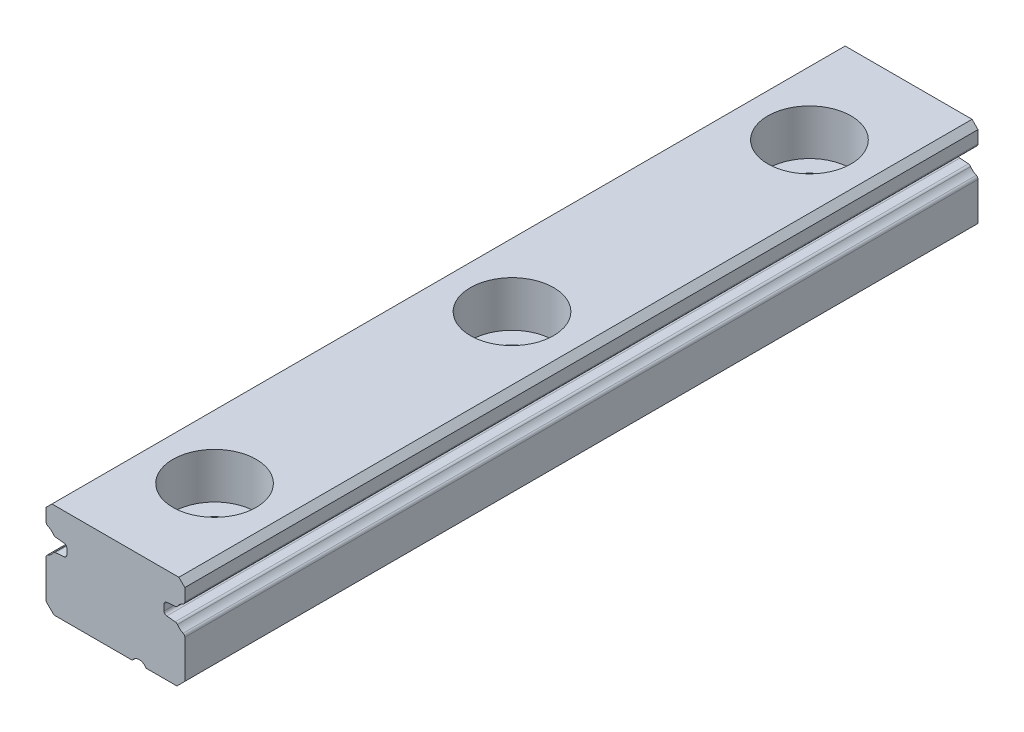
from build123d import *

# Parameters (mm, degrees)
BOSS_EXTRUDE1_START = 20
BOSS_EXTRUDE1_DEPTH = 40
LPATTERN1_COUNT     = 3
LPATTERN1_PITCH     = 15


with BuildPart() as part:
    # Sketch3 → Boss-Extrude1 (new body)
    with BuildSketch(Plane.XY.offset(BOSS_EXTRUDE1_START)):
        with BuildLine():
            Line((-3.5, -0.074596669), (-3.5, -2))
            Line((-3.5, -2), (-3.1, -2.4))
            Line((-3.1, -2.4), (0.853589838, -2.4))
            ThreePointArc((0.853589838, -2.4), (1.2, -2.2), (1.546410162, -2.4))
            Line((1.546410162, -2.4), (3.1, -2.4))
            Line((3.1, -2.4), (3.5, -2))
            Line((3.5, -2), (3.5, -0.074596669))
            ThreePointArc((3.5, -0.074596669), (3.476025208, 0.006752252), (3.411764706, 0.062096861))
            ThreePointArc((3.411764706, 0.062096861), (3.252980354, 0.161322512), (3.126179073, 0.299089108))
            ThreePointArc((3.126179073, 0.299089108), (3.078284539, 0.343044682), (3.016290807, 0.362608836))
            Line((3.016290807, 0.362608836), (2.586926639, 0.400173333))
            ThreePointArc((2.586926639, 0.400173333), (2.489408399, 0.448264007), (2.45, 0.549602538))
            Line((2.45, 0.549602538), (2.45, 0.850397462))
            ThreePointArc((2.45, 0.850397462), (2.489408399, 0.951735993), (2.586926639, 0.999826667))
            Line((2.586926639, 0.999826667), (3.016290807, 1.037391164))
            ThreePointArc((3.016290807, 1.037391164), (3.078284539, 1.056955318), (3.126179073, 1.100910892))
            ThreePointArc((3.126179073, 1.100910892), (3.252980354, 1.238677488), (3.411764706, 1.337903139))
            ThreePointArc((3.411764706, 1.337903139), (3.476025208, 1.393247748), (3.5, 1.474596669))
            Line((3.5, 1.474596669), (3.5, 2.1))
            Line((3.5, 2.1), (3.2, 2.4))
            Line((3.2, 2.4), (-3.2, 2.4))
            Line((-3.2, 2.4), (-3.5, 2.1))
            Line((-3.5, 2.1), (-3.5, 1.474596669))
            ThreePointArc((-3.5, 1.474596669), (-3.476025208, 1.393247748), (-3.411764706, 1.337903139))
            ThreePointArc((-3.411764706, 1.337903139), (-3.252980354, 1.238677488), (-3.126179073, 1.100910892))
            ThreePointArc((-3.126179073, 1.100910892), (-3.078284539, 1.056955318), (-3.016290807, 1.037391164))
            Line((-3.016290807, 1.037391164), (-2.586926639, 0.999826667))
            ThreePointArc((-2.586926639, 0.999826667), (-2.489408399, 0.951735993), (-2.45, 0.850397462))
            Line((-2.45, 0.850397462), (-2.45, 0.549602538))
            ThreePointArc((-2.45, 0.549602538), (-2.489408399, 0.448264006), (-2.586926639, 0.400173333))
            Line((-2.586926639, 0.400173333), (-3.016290807, 0.362608836))
            ThreePointArc((-3.016290807, 0.362608836), (-3.078284539, 0.343044682), (-3.126179073, 0.299089108))
            ThreePointArc((-3.126179073, 0.299089108), (-3.252980354, 0.161322512), (-3.411764706, 0.062096861))
            ThreePointArc((-3.411764706, 0.062096861), (-3.476025208, 0.006752252), (-3.5, -0.074596669))
        make_face()
    extrude(amount=-BOSS_EXTRUDE1_DEPTH)

    # Sketch4 → Cut-Revolve1 (revolve, cut)
    with BuildSketch(Plane.XY.offset(15)):
        Polygon((0, 2.4), (0, -2.4), (-1.2, -2.4), (-1.2, 0.1), (-2.1, 0.1), (-2.1, 2.4), align=None)
    cut_revolve1 = revolve(axis=Axis((0, 2.4, 15), (0, -1, 0)), mode=Mode.SUBTRACT)

    # LPattern1: Cut-Revolve1 ×3
    with Locations(*[(0, 0, -i * LPATTERN1_PITCH) for i in range(1, LPATTERN1_COUNT)]):
        add(cut_revolve1, mode=Mode.SUBTRACT)


solid = part.part
